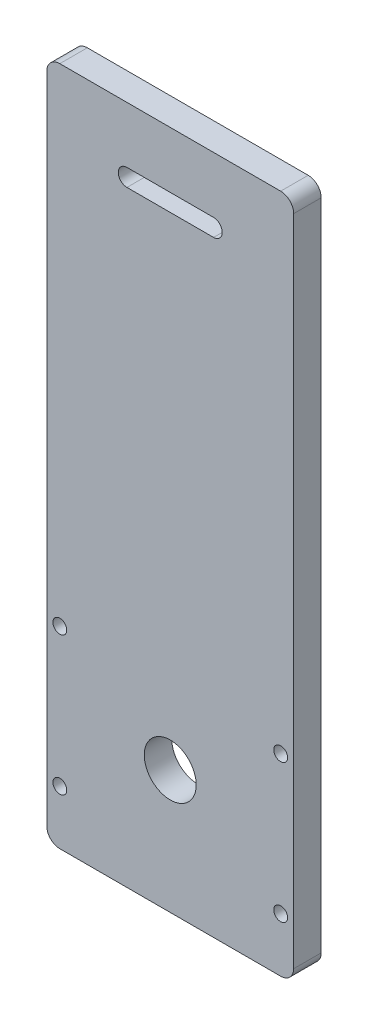
from build123d import *

# Parameters (mm, degrees)
SKETCH1_W           = 57
SKETCH1_H           = 100
SKETCH1_H_2         = 57
SKETCH1_R           = 6
BOSS_EXTRUDE1_DEPTH = 6.35
CUT_EXTRUDE2_DEPTH  = 132.775652152
FILLET1_R           = 3
SKETCH4_R           = 1.6
CUT_EXTRUDE3_DEPTH  = 132.775652152


with BuildPart() as part:
    # Sketch1 → Boss-Extrude1 (new body)
    # profile 1 of 2: a face of its own
    with BuildSketch(Plane.XY):
        with Locations((0, 78.5)):
            Rectangle(SKETCH1_W, SKETCH1_H)
    # profile 2 of 2: a face of its own
    with BuildSketch(Plane.XY):
        Rectangle(SKETCH1_W, SKETCH1_H_2)
        Circle(SKETCH1_R, mode=Mode.SUBTRACT)
    extrude(amount=BOSS_EXTRUDE1_DEPTH)

    # Sketch3 → Cut-Extrude2 (cut, through all)
    with BuildSketch(Plane.XY.offset(6.35)):
        with BuildLine():
            Line((-10, 115.5), (10, 115.5))
            ThreePointArc((10, 115.5), (12, 113.5), (10, 111.5))
            Line((10, 111.5), (-10, 111.5))
            ThreePointArc((-10, 111.5), (-12, 113.5), (-10, 115.5))
        make_face()
    extrude(amount=-CUT_EXTRUDE2_DEPTH, mode=Mode.SUBTRACT)

    # Fillet1
    fillet1_edges = [part.edges().sort_by_distance(p)[0] for p in [
        (-28.5, 128.5, 3.175),
        (28.5, 128.5, 3.175),
        (28.5, -28.5, 3.175),
        (-28.5, -28.5, 3.175),
    ]]
    fillet(fillet1_edges, radius=FILLET1_R)

    # Sketch4 → Cut-Extrude3 (cut, through all)
    with BuildSketch(Plane.XY.offset(6.35)):
        with Locations((25.5, -16)):
            Circle(SKETCH4_R)
        with Locations(Location((-25.5, -16, 0), (0, 0, 180))):
            Circle(SKETCH4_R)
        with Locations(Location((25.5, 16, 0), (0, 0, 180))):
            Circle(SKETCH4_R)
        with Locations((-25.5, 16)):
            Circle(SKETCH4_R)
    extrude(amount=-CUT_EXTRUDE3_DEPTH, mode=Mode.SUBTRACT)


solid = part.part
